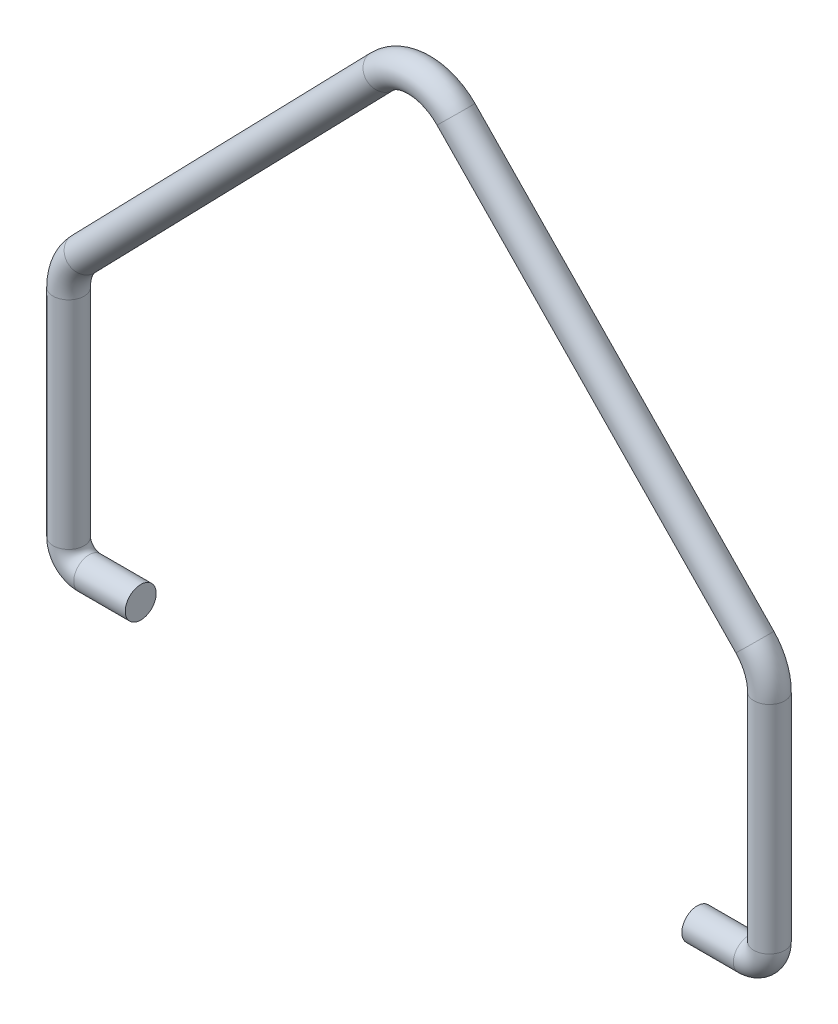
from build123d import *

# Parameters (mm, degrees)
SWEEP2_PROFILE_R = 1.5


with BuildPart() as part:
    # Sweep2: sweep along a path in Sketch1
    with BuildLine(Plane.XY) as sweep2_path:
        Line((27, 0), (32, 0))
        ThreePointArc((32, 0), (33.414213562, 0.585786438), (34, 2))
        Line((34, 2), (34, 22.971251236))
        ThreePointArc((34, 22.971251236), (33.633140648, 24.851146908), (32.586396904, 26.455179657))
        Line((32.586396904, 26.455179657), (3.586396904, 56.308120834))
        ThreePointArc((3.586396904, 56.308120834), (0, 57.824192412), (-3.586396904, 56.308120834))
        Line((-3.586396904, 56.308120834), (-32.586396904, 26.455179657))
        ThreePointArc((-32.586396904, 26.455179657), (-33.633140648, 24.851146908), (-34, 22.971251236))
        Line((-34, 22.971251236), (-34, 2))
        ThreePointArc((-34, 2), (-33.414213562, 0.585786438), (-32, 0))
        Line((-32, 0), (-27, 0))
    # Sweep2 profile (on start of the path) → Sweep2 (sweep)
    with BuildSketch(Plane(origin=(27, 0, 0), x_dir=(0, 0, 1), z_dir=(1, 0, 0))):
        Circle(SWEEP2_PROFILE_R)
    sweep(path=sweep2_path.line)


solid = part.part
